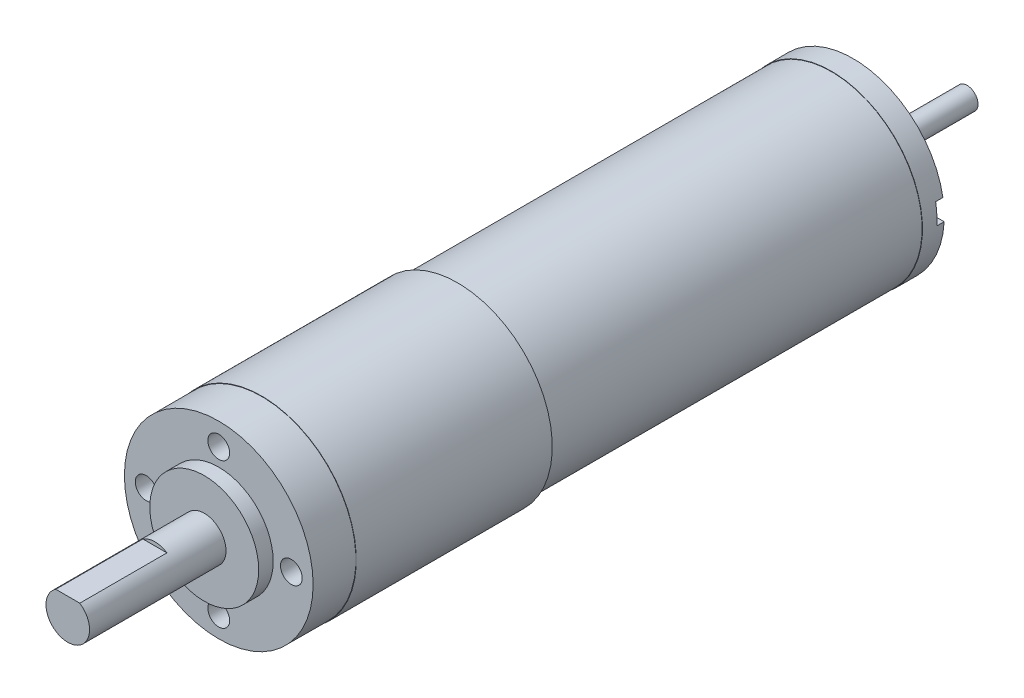
from build123d import *

# Parameters (mm, degrees)
ESQUISSE1_R             = 12.5
BOSS_EXTRU_1_DEPTH      = 54.5
ESQUISSE2_R             = 4
BOSS_EXTRU_2_DEPTH      = 1.35
ESQUISSE3_R             = 1.5
BOSS_EXTRU_3_DEPTH      = 15.7
ESQUISSE4_R             = 13
BOSS_EXTRU_4_DEPTH      = 32.9
ESQUISSE5_R             = 7.5
BOSS_EXTRU_5_DEPTH      = 2
ESQUISSE7_R             = 3
BOSS_EXTRU_6_DEPTH      = 20.8
ESQUISSE8_W             = 9.608231015
ESQUISSE8_H             = 12.440367957
ENL_V_MAT_EXTRU_1_DEPTH = 12
ESQUISSE9_R             = 1.5
ENL_V_MAT_EXTRU_2_DEPTH = 12
ESQUISSE10_R            = 13.05
BOSS_EXTRU_7_DEPTH      = 27
ESQUISSE11_R            = 12.55
BOSS_EXTRU_8_DEPTH      = 3
ESQUISSE12_R            = 1
ENL_V_MAT_EXTRU_4_DEPTH = 1


with BuildPart() as part:
    # Esquisse1 → Boss.-Extru.1 (new body)
    with BuildSketch(Plane.XY):
        Circle(ESQUISSE1_R)
    extrude(amount=BOSS_EXTRU_1_DEPTH)

    # Esquisse2 → Boss.-Extru.2 (add)
    with BuildSketch(Plane(origin=(0, 0, 0), x_dir=(-1, 0, 0), z_dir=(0, 0, -1))):
        with Locations(Location((0, 0, 0), (0, 0, 180))):
            Circle(ESQUISSE2_R)
    extrude(amount=BOSS_EXTRU_2_DEPTH)

    # Esquisse3 → Boss.-Extru.3 (add)
    with BuildSketch(Plane(origin=(0, 0, 0), x_dir=(-1, 0, 0), z_dir=(0, 0, -1))):
        Circle(ESQUISSE3_R)
    extrude(amount=BOSS_EXTRU_3_DEPTH)

    # Esquisse4 → Boss.-Extru.4 (add)
    with BuildSketch(Plane.XY.offset(54.5)):
        Circle(ESQUISSE4_R)
    extrude(amount=BOSS_EXTRU_4_DEPTH)

    # Esquisse5 → Boss.-Extru.5 (add)
    with BuildSketch(Plane.XY.offset(87.4)):
        Circle(ESQUISSE5_R)
    extrude(amount=BOSS_EXTRU_5_DEPTH)

    # Esquisse7 → Boss.-Extru.6 (add)
    with BuildSketch(Plane.XY.offset(87.4)):
        Circle(ESQUISSE7_R)
    extrude(amount=BOSS_EXTRU_6_DEPTH)

    # Esquisse8 → Enlèv. mat.-Extru.1 (cut)
    with BuildSketch(Plane.XY.offset(108.2)):
        with Locations((-0.725995737, 8.720183978)):
            Rectangle(ESQUISSE8_W, ESQUISSE8_H)
    extrude(amount=-ENL_V_MAT_EXTRU_1_DEPTH, mode=Mode.SUBTRACT)

    # Esquisse9 → Enlèv. mat.-Extru.2 (cut)
    with BuildSketch(Plane.XY.offset(87.4)):
        with Locations((-9.999727195, 0)):
            Circle(ESQUISSE9_R)
        with Locations((9.999727195, 0)):
            Circle(ESQUISSE9_R)
        with Locations((0, -10.073864879)):
            Circle(ESQUISSE9_R)
        with Locations((0, 9.926135121)):
            Circle(ESQUISSE9_R)
    extrude(amount=-ENL_V_MAT_EXTRU_2_DEPTH, mode=Mode.SUBTRACT)

    # Esquisse10 → Boss.-Extru.7 (add)
    with BuildSketch(Plane(origin=(0, 0, 54.5), x_dir=(-1, 0, 0), z_dir=(0, 0, -1))):
        Circle(ESQUISSE10_R)
    extrude(amount=-BOSS_EXTRU_7_DEPTH)

    # Esquisse11 → Boss.-Extru.8 (add)
    with BuildSketch(Plane(origin=(0, 0, 0), x_dir=(-1, 0, 0), z_dir=(0, 0, -1))):
        Circle(ESQUISSE11_R)
    extrude(amount=-BOSS_EXTRU_8_DEPTH)

    # Esquisse12 → Enlèv. mat.-Extru.4 (cut)
    with BuildSketch(Plane(origin=(0, 0, 0), x_dir=(-1, 0, 0), z_dir=(0, 0, -1))):
        with Locations((0, 8.5)):
            Circle(ESQUISSE12_R)
        with Locations((7.361215932, -4.25)):
            Circle(ESQUISSE12_R)
        with Locations((0, -8.5)):
            Circle(ESQUISSE12_R)
        with Locations((-7.361215932, -4.25)):
            Circle(ESQUISSE12_R)
        with BuildLine():
            Line((12.364465213, 2.15), (10.005928826, 2.15))
            Line((10.005928826, 2.15), (10.005928826, -0.65))
            Line((10.005928826, -0.65), (12.533156027, -0.65))
            ThreePointArc((12.533156027, -0.65), (12.527285654, 0.754727863), (12.364465213, 2.15))
        make_face()
        with BuildLine():
            Line((-12.533156027, -0.65), (-10.068828371, -0.65))
            Line((-10.068828371, -0.65), (-10.068828371, 2.15))
            Line((-10.068828371, 2.15), (-12.364465213, 2.15))
            ThreePointArc((-12.364465213, 2.15), (-12.527285654, 0.754727863), (-12.533156027, -0.65))
        make_face()
    extrude(amount=-ENL_V_MAT_EXTRU_4_DEPTH, mode=Mode.SUBTRACT)


solid = part.part
